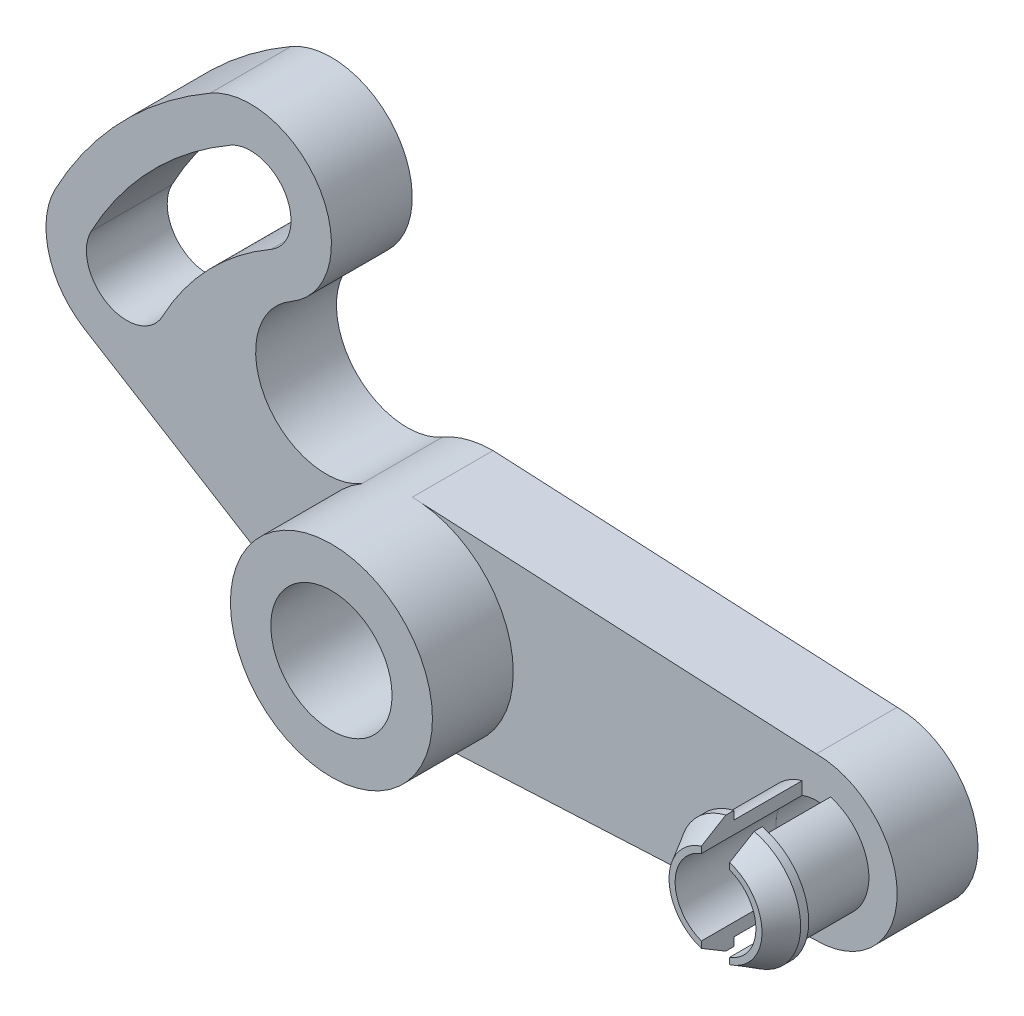
from build123d import *

# Parameters (mm, degrees)
ESQUISSE1_R             = 15
ESQUISSE1_R_2           = 10
BOSS_EXTRU_1_DEPTH      = 20
ESQUISSE2_R             = 25
ESQUISSE2_R_2           = 15
BOSS_EXTRU_2_DEPTH      = 20
CHANFREIN1_SIZE         = 2
ESQUISSE6_W             = 7
ESQUISSE6_H             = 34.355221185
ENL_V_MAT_EXTRU_2_DEPTH = 25


with BuildPart() as part:
    # Esquisse1 → Boss.-Extru.1 (new body)
    with BuildSketch(Plane.XY):
        with BuildLine():
            Line((0, -25), (100, -20))
            ThreePointArc((100, -20), (120, 0), (100, 20))
            Line((100, 20), (0, 25))
            ThreePointArc((0, 25), (-6.470476128, 24.148145657), (-12.5, 21.650635095))
            ThreePointArc((-12.5, 21.650635095), (-36.405444566, 28.056079661), (-30, 51.961524227))
            ThreePointArc((-30, 51.961524227), (-22.679491924, 79.282032303), (-50, 86.602540378))
            ThreePointArc((-50, 86.602540378), (-71.933980034, 69.465837046), (-88.294759286, 46.947156279))
            ThreePointArc((-88.294759286, 46.947156279), (-89.935062951, 32.30998872), (-81.108547088, 20.518895133))
            Line((-81.108547088, 20.518895133), (-12.5, -21.650635095))
            ThreePointArc((-12.5, -21.650635095), (-6.470476128, -24.148145657), (0, -25))
        make_face()
        Circle(ESQUISSE1_R, mode=Mode.SUBTRACT)
        with Locations((100, 0)):
            Circle(ESQUISSE1_R_2, mode=Mode.SUBTRACT)
        with BuildLine():
            ThreePointArc((-45, 77.942286341), (-64.74058203, 62.519253341), (-79.465283357, 42.252440651))
            ThreePointArc((-79.465283357, 42.252440651), (-75.330523057, 28.728249094), (-61.8063315, 32.863009395))
            ThreePointArc((-61.8063315, 32.863009395), (-50.353786024, 48.626085932), (-35, 60.621778265))
            ThreePointArc((-35, 60.621778265), (-31.339745962, 74.282032303), (-45, 77.942286341))
        make_face(mode=Mode.SUBTRACT)
    extrude(amount=BOSS_EXTRU_1_DEPTH)

    # Esquisse2 → Boss.-Extru.2 (add)
    with BuildSketch(Plane.XY.offset(20)):
        with Locations(Location((0, 0, 0), (0, 0, 236.846938275))):
            Circle(ESQUISSE2_R)
        Circle(ESQUISSE2_R_2, mode=Mode.SUBTRACT)
    extrude(amount=BOSS_EXTRU_2_DEPTH)

    # Chanfrein1
    chanfrein1_edges = [part.edges().sort_by_distance(p)[0] for p in [
        (-15, 0, 0),
    ]]
    chamfer(chanfrein1_edges, length=CHANFREIN1_SIZE)


with BuildPart() as body_2:
    # Esquisse5 → Révolution3 (revolve)
    with BuildSketch(Plane(origin=(100, 0, 0), x_dir=(0, 0, -1), z_dir=(1, 0, 0)), mode=Mode.PRIVATE) as r_volution3_sk:
        Polygon((-20, 10), (-44.953757377, 10), (-44.953757377, 11.5), (-38.891579551, 15), (-36.891579551, 15), (-36.891579551, 13), (-20, 13), align=None)
    revolve(r_volution3_sk.sketch.rotate(Axis((100, 0, 0), (0, 0, 1)), 90), axis=Axis((100, 0, 0), (0, 0, 1)))

    # Esquisse6 → Enlèv. mat.-Extru.2 (cut)
    with BuildSketch(Plane.XY.offset(44.953757377)):
        with Locations((100, -1.163018811)):
            Rectangle(ESQUISSE6_W, ESQUISSE6_H)
    extrude(amount=-ENL_V_MAT_EXTRU_2_DEPTH, mode=Mode.SUBTRACT)


with BuildPart() as enl_v_mat_extru_2_piece_1:
    # of the separate pieces the step leaves, piece 1, a body of its own (enl_v_mat_extru_2_pieces)
    add(body_2.part.solids().sort_by_distance((96.5, 9.367496998, 44.953757377))[0])


with BuildPart() as enl_v_mat_extru_2_piece_2:
    # of the separate pieces the step leaves, piece 2, a body of its own (enl_v_mat_extru_2_pieces)
    add(body_2.part.solids().sort_by_distance((103.5, -9.367496998, 20))[0])


solid = Compound([part.part, enl_v_mat_extru_2_piece_1.part, enl_v_mat_extru_2_piece_2.part])
